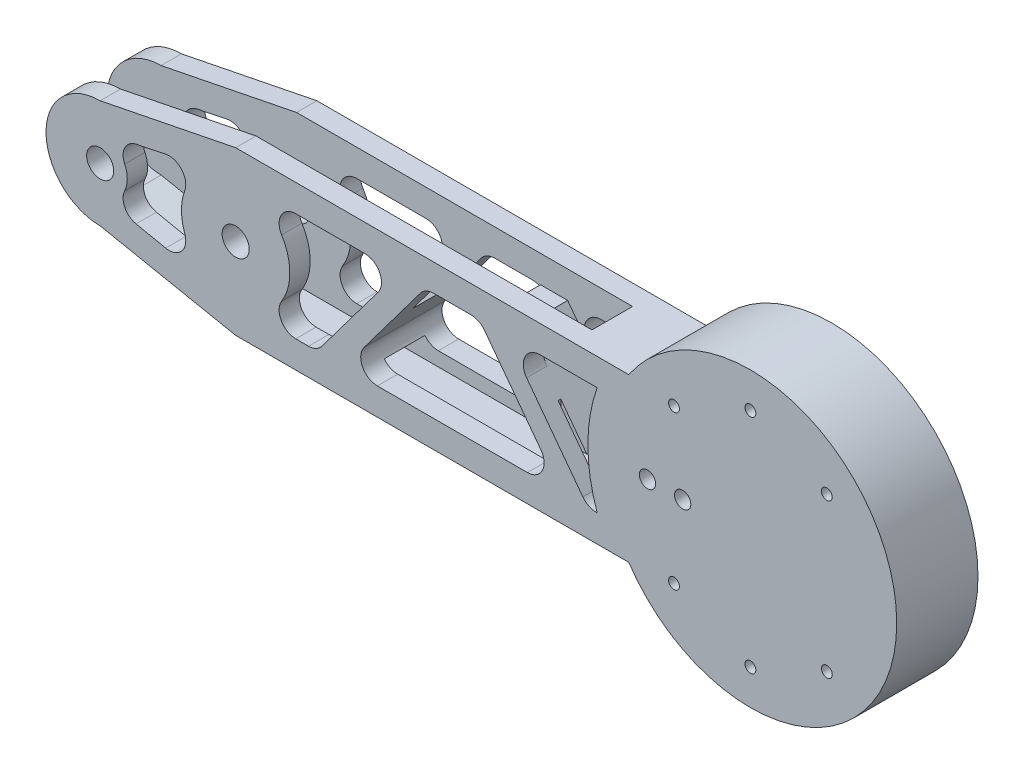
from build123d import *

# Parameters (mm, degrees)
EXTRUDE_1_DEPTH          = 60
EXTRUDE_1_DEPTH_BACK     = 70
EXTRUDE_2_DEPTH          = 7.5
EXTRUDE_2_DEPTH_BACK     = 7.5
SKETCH_2_R               = 27
SKETCH_2_R_2             = 23.5
CUT_EXTRUDE_1_DEPTH      = 7.5
CUT_EXTRUDE_1_DEPTH_BACK = 7.5
SKETCH_3_R               = 24.5
SKETCH_4_R               = 24.5
EXTRUDE_3_DEPTH          = 3
EXTRUDE_4_DEPTH          = 2.58
SKETCH_6_R               = 1
CUT_EXTRUDE_2_DEPTH      = 3
SKETCH_7_R               = 1.5
CUT_EXTRUDE_3_DEPTH      = 5.58
CUT_EXTRUDE_4_DEPTH      = 97
CUT_EXTRUDE_5_DEPTH      = 1
CUT_EXTRUDE_5_DEPTH_BACK = 15
CUT_EXTRUDE_6_DEPTH      = 92.401586419
CUT_EXTRUDE_6_DEPTH_BACK = 7.5
SKETCH_10_R              = 2.5
EXTRUDE_5_DEPTH          = 4
EXTRUDE_5_DEPTH_BACK     = 4
EXTRUDE_6_DEPTH          = 4
EXTRUDE_6_DEPTH_BACK     = 4


with BuildPart() as part:
    # 草图1 → 凸台-拉伸1 (new, two sides: drawn at the far end of the back side and taken through both)
    with BuildSketch(Plane(origin=(0, 0, 0), x_dir=(0, 0, -1), z_dir=(1, 0, 0)).offset(-EXTRUDE_1_DEPTH_BACK)):
        Polygon((7.5, 0), (7.5, 15), (-7.5, 15), (-7.5, -15), (7.5, -15), align=None)
    extrude(amount=EXTRUDE_1_DEPTH + EXTRUDE_1_DEPTH_BACK)

    # 草图2 → 凸台-拉伸2 (add, two sides: drawn at the far end of the back side and taken through both)
    with BuildSketch(Plane.XY.offset(-EXTRUDE_2_DEPTH_BACK)):
        with Locations((60, 0)):
            Circle(SKETCH_2_R)
        with Locations((60, 0)):
            Circle(SKETCH_2_R_2, mode=Mode.SUBTRACT)
    extrude(amount=EXTRUDE_2_DEPTH + EXTRUDE_2_DEPTH_BACK)

    # 草图3 → 切除-拉伸1 (cut, two sides: drawn at the far end of the back side and taken through both)
    with BuildSketch(Plane.XY.offset(-CUT_EXTRUDE_1_DEPTH_BACK)):
        with Locations((60, 0)):
            Circle(SKETCH_3_R)
    extrude(amount=CUT_EXTRUDE_1_DEPTH + CUT_EXTRUDE_1_DEPTH_BACK, mode=Mode.SUBTRACT)

    # 草图4 → 凸台-拉伸3 (add)
    with BuildSketch(Plane.XY.offset(7.5)):
        with Locations((60, 0)):
            Circle(SKETCH_4_R)
    extrude(amount=-EXTRUDE_3_DEPTH)

    # 草图5 → 凸台-拉伸4 (add)
    with BuildSketch(Plane(origin=(0, 0, 4.5), x_dir=(-1, 0, 0), z_dir=(0, 0, -1))):
        Polygon((-36.5, 0), (-36.5, 4), (-40.5, 4), (-45.5, 4), (-50.5, 4), (-50.5, 0), (-50.5, -4), (-36.5, -4), align=None)
    extrude(amount=EXTRUDE_4_DEPTH)

    # 草图6 → 切除-拉伸2 (cut)
    with BuildSketch(Plane(origin=(0, 0, 4.5), x_dir=(-1, 0, 0), z_dir=(0, 0, -1))):
        with Locations((-60, 20.5)):
            Circle(SKETCH_6_R)
        with Locations((-60, -20.5)):
            Circle(SKETCH_6_R)
        with Locations((-45.894936823, 14.179111142)):
            Circle(SKETCH_6_R)
        with Locations((-74.105063177, 14.179111142)):
            Circle(SKETCH_6_R)
        with Locations((-74.105063177, -14.179111142)):
            Circle(SKETCH_6_R)
        with Locations((-45.894936823, -14.179111142)):
            Circle(SKETCH_6_R)
    extrude(amount=-CUT_EXTRUDE_2_DEPTH, mode=Mode.SUBTRACT)

    # 草图7 → 切除-拉伸3 (cut)
    with BuildSketch(Plane(origin=(0, 0, 1.92), x_dir=(-1, 0, 0), z_dir=(0, 0, -1))):
        with Locations((-47.5, 0)):
            Circle(SKETCH_7_R)
        with Locations((-41, 0)):
            Circle(SKETCH_7_R)
    extrude(amount=-CUT_EXTRUDE_3_DEPTH, mode=Mode.SUBTRACT)

    # 草图8 → 切除-拉伸4 (cut)
    with BuildSketch(Plane.ZY.offset(70)):
        Polygon((0, 15), (-3.75, 15), (-3.75, -15), (3.75, -15), (3.75, 15), align=None)
    extrude(amount=-CUT_EXTRUDE_4_DEPTH, mode=Mode.SUBTRACT)

    # 草图9 → 切除-拉伸5 (cut, two sides: drawn at the far end of the back side and taken through both)
    with BuildSketch(Plane(origin=(36.5, 0, 0), x_dir=(0, 0, -1), z_dir=(1, 0, 0)).offset(-CUT_EXTRUDE_5_DEPTH_BACK)):
        Polygon((3.75, -9.1), (3.75, 0), (3.75, 9.1), (-4.5, 9.1), (-4.5, -9.1), align=None)
    extrude(amount=CUT_EXTRUDE_5_DEPTH + CUT_EXTRUDE_5_DEPTH_BACK, mode=Mode.SUBTRACT)

    # 草图10 → 切除-拉伸6 (cut, two sides: drawn at the far end of the back side and taken through both)
    with BuildSketch(Plane.XY.offset(-CUT_EXTRUDE_6_DEPTH_BACK)):
        with BuildLine():
            ThreePointArc((-60, -10), (-67.071067841, -7.071067782), (-70, 8.3e-08))
            Line((-70, 8.3e-08), (-70, -15))
            Line((-70, -15), (-35, -15))
            Line((-35, -15), (-60, -10))
        make_face()
        with BuildLine():
            Line((-60, 10), (-35, 15))
            Line((-35, 15), (-70, 15))
            Line((-70, 15), (-70, 8.3e-08))
            ThreePointArc((-70, 8.3e-08), (-67.071067782, 7.071067841), (-60, 10))
        make_face()
        with BuildLine():
            Line((-47.910318504, 7.502760494), (-53.381882594, 6.370057829))
            ThreePointArc((-53.381882594, 6.370057829), (-55.459731516, 4.768530579), (-55.483580368, 2.145216472))
            ThreePointArc((-55.483580368, 2.145216472), (-55, 0), (-55.483580368, -2.145216472))
            ThreePointArc((-55.483580368, -2.145216472), (-55.459731516, -4.768530579), (-53.381882594, -6.370057829))
            Line((-53.381882594, -6.370057829), (-47.910318504, -7.502760494))
            ThreePointArc((-47.910318504, -7.502760494), (-44.955257563, -6.500012961), (-44.393173811, -3.430493514))
            ThreePointArc((-44.393173811, -3.430493514), (-45, 0), (-44.393173811, 3.430493514))
            ThreePointArc((-44.393173811, 3.430493514), (-44.955257563, 6.500012961), (-47.910318504, 7.502760494))
        make_face()
        with BuildLine():
            Line((-11.159432091, 10), (-23.900962122, 10))
            ThreePointArc((-23.900962122, 10), (-26.593808125, 8.414683944), (-26.514312819, 5.290851828))
            ThreePointArc((-26.514312819, 5.290851828), (-25, 0), (-26.514312819, -5.290851828))
            ThreePointArc((-26.514312819, -5.290851828), (-26.593808125, -8.414683944), (-23.900962122, -10))
            Line((-23.900962122, -10), (-21.539858023, -10))
            ThreePointArc((-21.539858023, -10), (-20.162567137, -9.674865726), (-19.076085186, -8.768113582))
            Line((-19.076085186, -8.768113582), (-8.695659254, 5.072454327))
            ThreePointArc((-8.695659254, 5.072454327), (-8.404850319, 8.29757484), (-11.159432091, 10))
        make_face()
        with BuildLine():
            Line((-0.923914814, 8.768113582), (-11.304340746, -5.072454327))
            ThreePointArc((-11.304340746, -5.072454327), (-11.595149681, -8.29757484), (-8.840567909, -10))
            Line((-8.840567909, -10), (18.840567909, -10))
            ThreePointArc((18.840567909, -10), (21.595149681, -8.29757484), (21.304340746, -5.072454327))
            Line((21.304340746, -5.072454327), (10.923914814, 8.768113582))
            ThreePointArc((10.923914814, 8.768113582), (9.837432863, 9.674865726), (8.460141977, 10))
            Line((8.460141977, 10), (1.539858023, 10))
            ThreePointArc((1.539858023, 10), (0.162567137, 9.674865726), (-0.923914814, 8.768113582))
        make_face()
        with BuildLine():
            ThreePointArc((21.159432091, 10), (18.404850319, 8.29757484), (18.695659254, 5.072454327))
            Line((18.695659254, 5.072454327), (29.076085186, -8.768113582))
            ThreePointArc((29.076085186, -8.768113582), (30.162567137, -9.674865726), (31.539858023, -10))
            Line((31.539858023, -10), (31.715728753, -10))
            ThreePointArc((31.715728753, -10), (30, 0), (31.715728753, 10))
            Line((31.715728753, 10), (21.159432091, 10))
        make_face()
        with Locations((-60, 0)):
            Circle(SKETCH_10_R)
        with Locations((-35, 0)):
            Circle(SKETCH_10_R)
    extrude(amount=CUT_EXTRUDE_6_DEPTH + CUT_EXTRUDE_6_DEPTH_BACK, mode=Mode.SUBTRACT)

    # 草图11 → 凸台-拉伸5 (add, two sides: drawn at the far end of the back side and taken through both)
    with BuildSketch(Plane.XY.offset(-EXTRUDE_5_DEPTH_BACK)):
        with BuildLine():
            Line((-60, -7.5), (-34.519230769, -12.596153846))
            Line((-34.519230769, -12.596153846), (32.772497208, -12.596153846))
            ThreePointArc((32.772497208, -12.596153846), (33.368731111, -13.812151076), (34.019237886, -15))
            Line((34.019237886, -15), (-35, -15))
            Line((-35, -15), (-60, -10))
            ThreePointArc((-60, -10), (-62.588190451, -9.659258263), (-65, -8.660254038))
            Line((-65, -8.660254038), (-63.75, -6.495190528))
            ThreePointArc((-63.75, -6.495190528), (-61.941142838, -7.244443697), (-60, -7.5))
        make_face()
    extrude(amount=EXTRUDE_5_DEPTH + EXTRUDE_5_DEPTH_BACK)

    # 草图12 → 凸台-拉伸6 (add, two sides: drawn at the far end of the back side and taken through both)
    with BuildSketch(Plane.XY.offset(-EXTRUDE_6_DEPTH_BACK)):
        Polygon((13.695659254, 5.072454327), (21.304340746, -5.072454327), (26.304340746, -5.072454327), (18.695659254, 5.072454327), (15.018615082, 9.975179891), (10.018615082, 9.975179891), align=None)
        with BuildLine():
            Line((-19.076085186, -8.768113582), (-11.304340746, -8.768113582))
            ThreePointArc((-11.304340746, -8.768113582), (-11.920283955, -6.920283955), (-11.304340746, -5.072454327))
            Line((-11.304340746, -5.072454327), (-6.11412778, 1.847829627))
            Line((-6.11412778, 1.847829627), (-16.637943127, -5.517257503))
            Line((-16.637943127, -5.517257503), (-19.076085186, -8.768113582))
        make_face()
    extrude(amount=EXTRUDE_6_DEPTH + EXTRUDE_6_DEPTH_BACK)


solid = part.part
